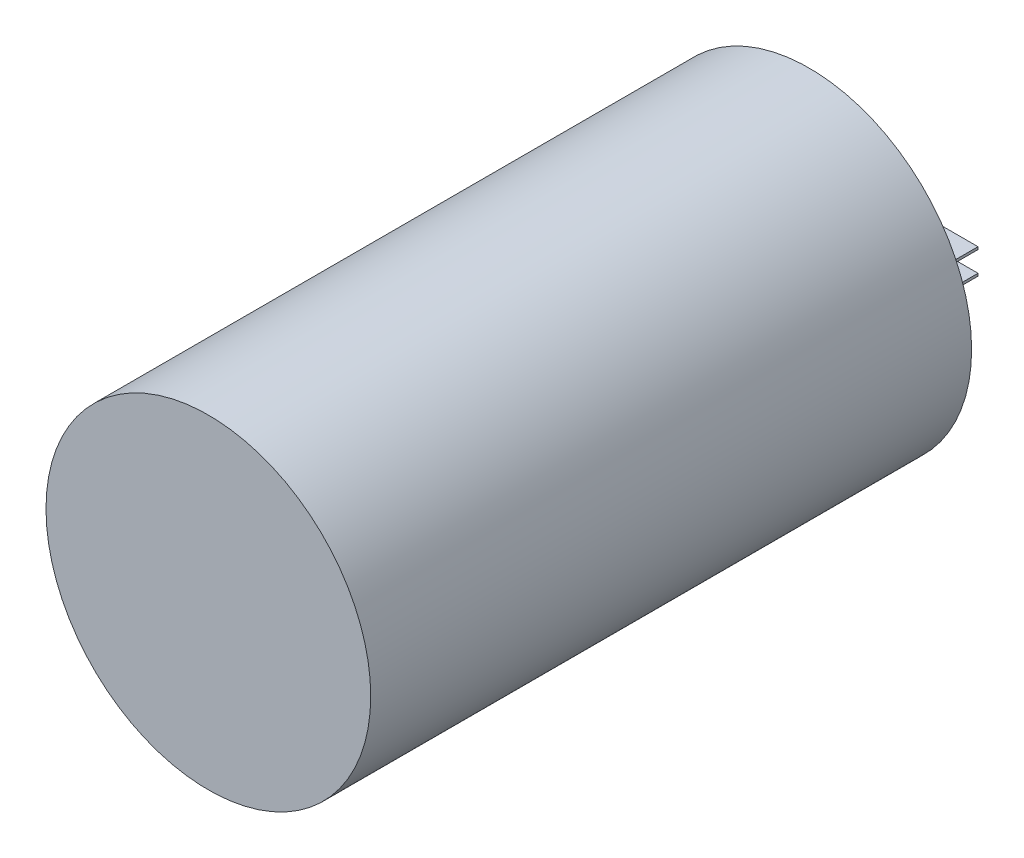
from build123d import *

# Parameters (mm, degrees)
SKETCH1_R           = 12.7
BOSS_EXTRUDE1_DEPTH = 47
SKETCH2_W           = 14
SKETCH2_H           = 2
BOSS_EXTRUDE2_DEPTH = 6.2
SKETCH3_W           = 14
SKETCH3_H           = 1.6
CUT_EXTRUDE1_DEPTH  = 6.2


with BuildPart() as part:
    # Sketch1 → Boss-Extrude1 (new body)
    with BuildSketch(Plane.XY):
        Circle(SKETCH1_R)
    extrude(amount=BOSS_EXTRUDE1_DEPTH)

    # Sketch2 → Boss-Extrude2 (add)
    with BuildSketch(Plane(origin=(0, 0, 0), x_dir=(-1, 0, 0), z_dir=(0, 0, -1))):
        Rectangle(SKETCH2_W, SKETCH2_H)
    extrude(amount=BOSS_EXTRUDE2_DEPTH)

    # Sketch3 → Cut-Extrude1 (cut)
    with BuildSketch(Plane(origin=(0, 0, -6.2), x_dir=(-1, 0, 0), z_dir=(0, 0, -1))):
        Rectangle(SKETCH3_W, SKETCH3_H)
    extrude(amount=-CUT_EXTRUDE1_DEPTH, mode=Mode.SUBTRACT)


solid = part.part
